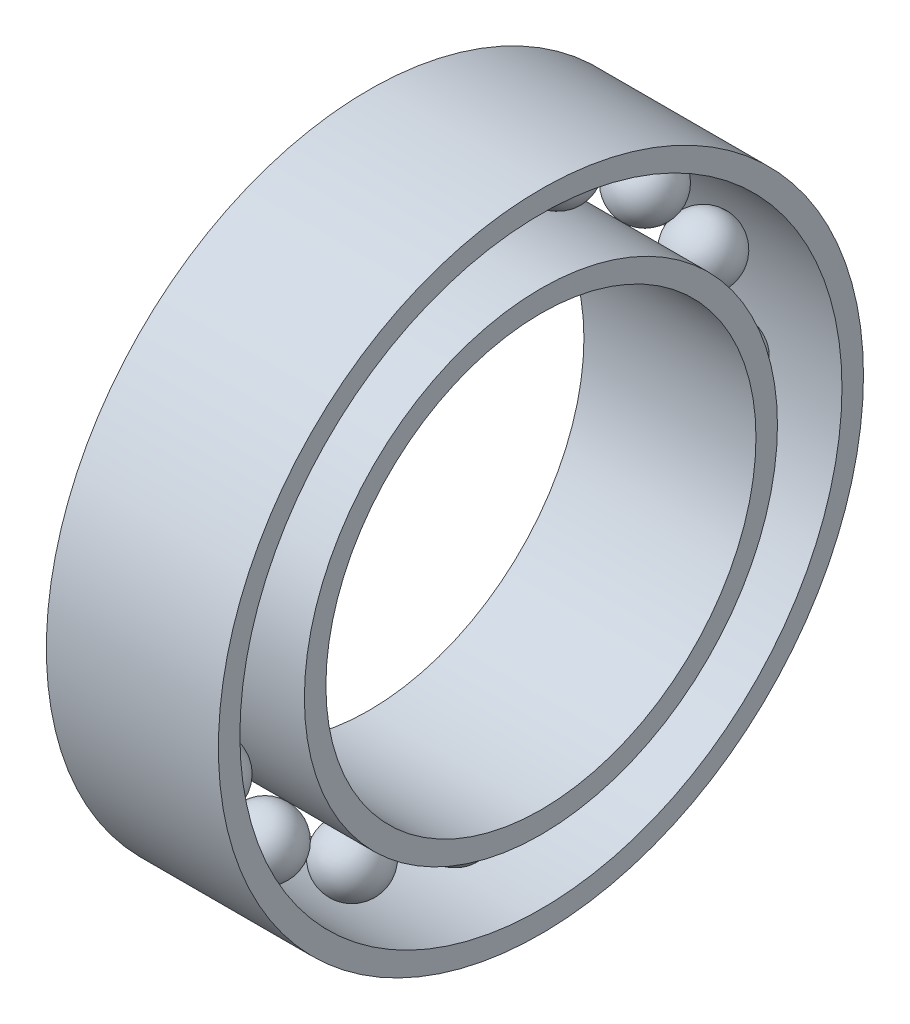
from build123d import *

# Parameters (mm, degrees)
EXTRUDE_1_DEPTH          = 2
EXTRUDE_1_DEPTH_BACK     = 2
SKETCH_1_4_R             = 5.5
SKETCH_1_4_R_2           = 5
EXTRUDE_1_2_DEPTH        = 2
EXTRUDE_1_2_DEPTH_BACK   = 2
SKETCH_1_4_R_3           = 7.5
SKETCH_1_4_R_4           = 7
PATTERN_CIRCULAR_6_COUNT = 16


with BuildPart() as part:
    # 草图1 → 旋转1 (revolve)
    with BuildSketch(Plane(origin=(0, 0, 0), x_dir=(0, 0, -1), z_dir=(1, 0, 0))):
        with BuildLine():
            Line((0, 7), (0, 5.5))
            ThreePointArc((0, 5.5), (0.75, 6.25), (0, 7))
        make_face()
    revolve(axis=Axis((0, 7, 0), (0, -1, 0)))


with BuildPart() as body_2:
    # 草图1<4> → 凸台-拉伸1 (new, two sides: drawn at the far end of the back side and taken through both)
    with BuildSketch(Plane(origin=(0, 0, 0), x_dir=(0, 0, -1), z_dir=(1, 0, 0)).offset(-EXTRUDE_1_DEPTH_BACK)):
        Circle(SKETCH_1_4_R)
        Circle(SKETCH_1_4_R_2, mode=Mode.SUBTRACT)
    extrude(amount=EXTRUDE_1_DEPTH + EXTRUDE_1_DEPTH_BACK)


with BuildPart() as body_3:
    # 草图1<4> → Extrude 1 2 (new, two sides: drawn at the far end of the back side and taken through both)
    with BuildSketch(Plane(origin=(0, 0, 0), x_dir=(0, 0, -1), z_dir=(1, 0, 0)).offset(-EXTRUDE_1_2_DEPTH_BACK)):
        Circle(SKETCH_1_4_R_3)
        Circle(SKETCH_1_4_R_4, mode=Mode.SUBTRACT)
    extrude(amount=EXTRUDE_1_2_DEPTH + EXTRUDE_1_2_DEPTH_BACK)


with BuildPart() as pattern_circular_6_1:
    # 阵列(圆周)6: pattern copy
    add(part.part.rotate(Axis((2, 0, 0), (1, 0, 0)), 1 * 360 / PATTERN_CIRCULAR_6_COUNT))


with BuildPart() as pattern_circular_6_2:
    # 阵列(圆周)6: pattern copy
    add(part.part.rotate(Axis((2, 0, 0), (1, 0, 0)), 2 * 360 / PATTERN_CIRCULAR_6_COUNT))


with BuildPart() as pattern_circular_6_3:
    # 阵列(圆周)6: pattern copy
    add(part.part.rotate(Axis((2, 0, 0), (1, 0, 0)), 3 * 360 / PATTERN_CIRCULAR_6_COUNT))


with BuildPart() as pattern_circular_6_4:
    # 阵列(圆周)6: pattern copy
    add(part.part.rotate(Axis((2, 0, 0), (1, 0, 0)), 4 * 360 / PATTERN_CIRCULAR_6_COUNT))


with BuildPart() as pattern_circular_6_5:
    # 阵列(圆周)6: pattern copy
    add(part.part.rotate(Axis((2, 0, 0), (1, 0, 0)), 5 * 360 / PATTERN_CIRCULAR_6_COUNT))


with BuildPart() as pattern_circular_6_6:
    # 阵列(圆周)6: pattern copy
    add(part.part.rotate(Axis((2, 0, 0), (1, 0, 0)), 6 * 360 / PATTERN_CIRCULAR_6_COUNT))


with BuildPart() as pattern_circular_6_7:
    # 阵列(圆周)6: pattern copy
    add(part.part.rotate(Axis((2, 0, 0), (1, 0, 0)), 7 * 360 / PATTERN_CIRCULAR_6_COUNT))


with BuildPart() as pattern_circular_6_8:
    # 阵列(圆周)6: pattern copy
    add(part.part.rotate(Axis((2, 0, 0), (1, 0, 0)), 8 * 360 / PATTERN_CIRCULAR_6_COUNT))


with BuildPart() as pattern_circular_6_9:
    # 阵列(圆周)6: pattern copy
    add(part.part.rotate(Axis((2, 0, 0), (1, 0, 0)), 9 * 360 / PATTERN_CIRCULAR_6_COUNT))


with BuildPart() as pattern_circular_6_10:
    # 阵列(圆周)6: pattern copy
    add(part.part.rotate(Axis((2, 0, 0), (1, 0, 0)), 10 * 360 / PATTERN_CIRCULAR_6_COUNT))


with BuildPart() as pattern_circular_6_11:
    # 阵列(圆周)6: pattern copy
    add(part.part.rotate(Axis((2, 0, 0), (1, 0, 0)), 11 * 360 / PATTERN_CIRCULAR_6_COUNT))


with BuildPart() as pattern_circular_6_12:
    # 阵列(圆周)6: pattern copy
    add(part.part.rotate(Axis((2, 0, 0), (1, 0, 0)), 12 * 360 / PATTERN_CIRCULAR_6_COUNT))


with BuildPart() as pattern_circular_6_13:
    # 阵列(圆周)6: pattern copy
    add(part.part.rotate(Axis((2, 0, 0), (1, 0, 0)), 13 * 360 / PATTERN_CIRCULAR_6_COUNT))


with BuildPart() as pattern_circular_6_14:
    # 阵列(圆周)6: pattern copy
    add(part.part.rotate(Axis((2, 0, 0), (1, 0, 0)), 14 * 360 / PATTERN_CIRCULAR_6_COUNT))


with BuildPart() as pattern_circular_6_15:
    # 阵列(圆周)6: pattern copy
    add(part.part.rotate(Axis((2, 0, 0), (1, 0, 0)), 15 * 360 / PATTERN_CIRCULAR_6_COUNT))


solid = Compound([part.part, body_2.part, body_3.part, pattern_circular_6_1.part, pattern_circular_6_2.part, pattern_circular_6_3.part, pattern_circular_6_4.part, pattern_circular_6_5.part, pattern_circular_6_6.part, pattern_circular_6_7.part, pattern_circular_6_8.part, pattern_circular_6_9.part, pattern_circular_6_10.part, pattern_circular_6_11.part, pattern_circular_6_12.part, pattern_circular_6_13.part, pattern_circular_6_14.part, pattern_circular_6_15.part])
